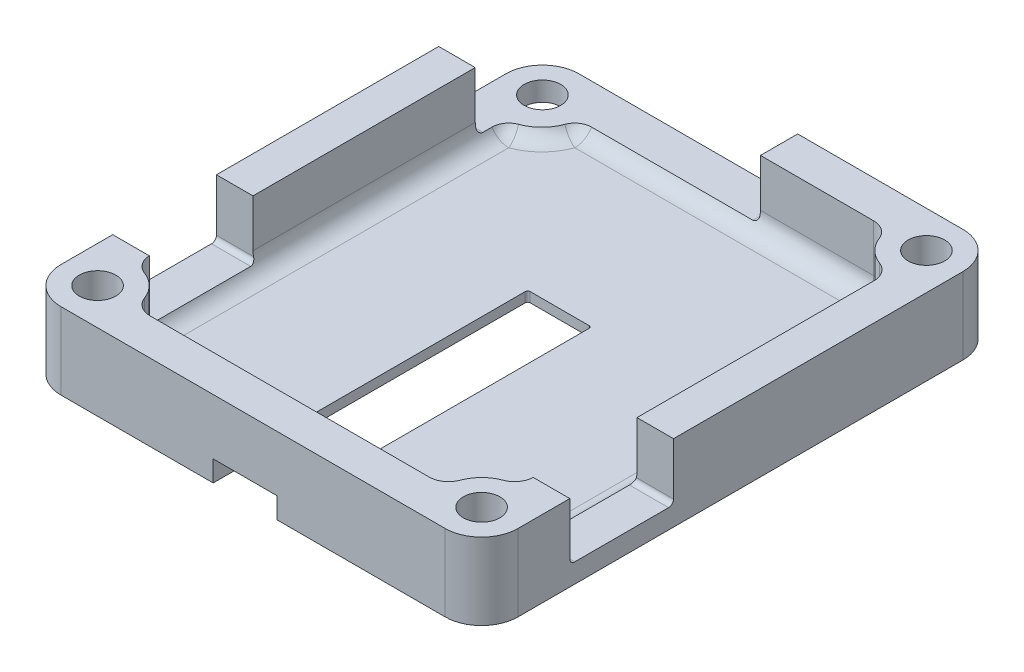
from build123d import *

# Parameters (mm, degrees)
SKETCH1_R               = 2.9972
BOSS_EXTRUDE1_DEPTH     = 12.573
CUT_EXTRUDE3_DEPTH      = 62.511402554
CUT_EXTRUDE3_DEPTH_BACK = 10.9728
FILLET1_R               = 3.175
CUT_EXTRUDE1_DEPTH      = 3.429
CUT_EXTRUDE1_DEPTH_BACK = 62.511402554
SKETCH6_W               = 75.0062
SKETCH6_H               = 17.018
SKETCH6_W_2             = 41.8846
CUT_EXTRUDE4_DEPTH      = 9.398
FILLET2_R               = 0.8128


with BuildPart() as part:
    # Sketch1 → Boss-Extrude1 (new body)
    with BuildSketch(Plane(origin=(0, 0, 0), x_dir=(1, 0, 0), z_dir=(0, 1, 0))):
        with BuildLine():
            Line((-29.1688495, -45.1454495), (33.8485505, -45.1454495))
            ThreePointArc((33.8485505, -45.1454495), (38.087231389, -43.389730389), (39.8429505, -39.1510495))
            Line((39.8429505, -39.1510495), (39.8429505, 33.8485505))
            ThreePointArc((39.8429505, 33.8485505), (38.087231389, 38.087231389), (33.8485505, 39.8429505))
            Line((33.8485505, 39.8429505), (-29.1688495, 39.8429505))
            ThreePointArc((-29.1688495, 39.8429505), (-33.407530389, 38.087231389), (-35.1632495, 33.8485505))
            Line((-35.1632495, 33.8485505), (-35.1632495, -39.1510495))
            ThreePointArc((-35.1632495, -39.1510495), (-33.407530389, -43.389730389), (-29.1688495, -45.1454495))
        make_face()
        with Locations(Location((-29.1688495, 33.8485505, 0), (0, 0, 270))):
            Circle(SKETCH1_R, mode=Mode.SUBTRACT)
        with Locations(Location((33.8485505, 33.8485505, 0), (0, 0, 270))):
            Circle(SKETCH1_R, mode=Mode.SUBTRACT)
        with Locations(Location((33.8485505, -39.1510495, 0), (0, 0, 270))):
            Circle(SKETCH1_R, mode=Mode.SUBTRACT)
        with Locations(Location((-29.1688495, -39.1510495, 0), (0, 0, 270))):
            Circle(SKETCH1_R, mode=Mode.SUBTRACT)
    extrude(amount=BOSS_EXTRUDE1_DEPTH)

    # Sketch5 → Cut-Extrude3 (cut, two sides: drawn at the far end of the back side and taken through both)
    with BuildSketch(Plane(origin=(0, 12.573, 0), x_dir=(1, 0, 0), z_dir=(0, 1, 0)).offset(-CUT_EXTRUDE3_DEPTH_BACK)):
        with BuildLine():
            Line((-20.566682833, -39.1510495), (25.246383833, -39.1510495))
            ThreePointArc((25.246383833, -39.1510495), (27.061611626, -38.580962754), (28.224973399, -37.075426231))
            ThreePointArc((28.224973399, -37.075426231), (29.609869611, -34.912368611), (31.772927231, -33.527472399))
            ThreePointArc((31.772927231, -33.527472399), (33.278463754, -32.364110626), (33.8485505, -30.548882833))
            Line((33.8485505, -30.548882833), (33.8485505, 25.246383833))
            ThreePointArc((33.8485505, 25.246383833), (33.278463754, 27.061611626), (31.772927231, 28.224973399))
            ThreePointArc((31.772927231, 28.224973399), (29.637195811, 29.582718454), (28.25211412, 31.700823514))
            ThreePointArc((28.25211412, 31.700823514), (27.086350512, 33.179780767), (25.287899936, 33.738256255))
            Line((25.287899936, 33.738256255), (-20.566682833, 33.738256255))
            ThreePointArc((-20.566682833, 33.738256255), (-22.381910626, 33.168169509), (-23.545272399, 31.662632986))
            ThreePointArc((-23.545272399, 31.662632986), (-24.930168611, 29.499575366), (-27.093226231, 28.114679154))
            ThreePointArc((-27.093226231, 28.114679154), (-28.598762754, 26.951317381), (-29.1688495, 25.136089588))
            Line((-29.1688495, 25.136089588), (-29.1688495, -30.548882833))
            ThreePointArc((-29.1688495, -30.548882833), (-28.598762754, -32.364110626), (-27.093226231, -33.527472399))
            ThreePointArc((-27.093226231, -33.527472399), (-24.930168611, -34.912368611), (-23.545272399, -37.075426231))
            ThreePointArc((-23.545272399, -37.075426231), (-22.381910626, -38.580962754), (-20.566682833, -39.1510495))
        make_face()
    extrude(amount=CUT_EXTRUDE3_DEPTH + CUT_EXTRUDE3_DEPTH_BACK, mode=Mode.SUBTRACT)

    # Fillet1
    fillet1_edges = [part.edges().sort_by_distance(p)[0] for p in [
        (-22.381910626, 1.6002, -33.168169509),
        (-24.930168611, 1.6002, -29.499575366),
        (-28.598762754, 1.6002, -26.951317381),
        (-29.1688495, 1.6002, 2.706396623),
        (2.3398505, 1.6002, 39.1510495),
        (27.061611626, 1.6002, 38.580962754),
        (29.609869611, 1.6002, 34.912368611),
        (33.278463754, 1.6002, 32.364110626),
        (33.8485505, 1.6002, 2.6512495),
        (33.278463754, 1.6002, -27.061611626),
        (29.637195811, 1.6002, -29.582718454),
        (27.086350512, 1.6002, -33.179780767),
        (2.360608551, 1.6002, -33.738256255),
        (-28.598762754, 1.6002, 32.364110626),
        (-24.930168611, 1.6002, 34.912368611),
        (-22.381910626, 1.6002, 38.580962754),
    ]]
    fillet(fillet1_edges, radius=FILLET1_R)

    # Sketch2 → Cut-Extrude1 (cut, two sides: drawn at the far end of the back side and taken through both)
    with BuildSketch(Plane(origin=(0, 0, 0), x_dir=(1, 0, 0), z_dir=(0, 1, 0)).offset(-CUT_EXTRUDE1_DEPTH_BACK)):
        with BuildLine():
            Line((-4.2006495, -45.1454495), (6.2641505, -45.1454495))
            Line((6.2641505, -45.1454495), (6.2641505, 6.0609505))
            ThreePointArc((6.2641505, 6.0609505), (6.145118696, 6.348318696), (5.8577505, 6.4673505))
            Line((5.8577505, 6.4673505), (-3.7942495, 6.4673505))
            ThreePointArc((-3.7942495, 6.4673505), (-4.081617696, 6.348318696), (-4.2006495, 6.0609505))
            Line((-4.2006495, 6.0609505), (-4.2006495, -45.1454495))
        make_face()
    extrude(amount=CUT_EXTRUDE1_DEPTH + CUT_EXTRUDE1_DEPTH_BACK, mode=Mode.SUBTRACT)

    # Sketch6 → Cut-Extrude4 (cut)
    with BuildSketch(Plane(origin=(0, 12.573, 0), x_dir=(1, 0, 0), z_dir=(0, 1, 0))):
        with Locations((2.3398505, -22.1584495)):
            Rectangle(SKETCH6_W, SKETCH6_H)
        with Locations((-14.2209495, 31.3339505)):
            Rectangle(SKETCH6_W_2, SKETCH6_H)
    extrude(amount=-CUT_EXTRUDE4_DEPTH, mode=Mode.SUBTRACT)

    # Fillet2
    fillet2_edges = [part.edges().sort_by_distance(p)[0] for p in [
        (36.629380049, 3.175, 13.6494495),
        (36.628097837, 3.175, 30.6674495),
        (-31.948396837, 3.175, 30.6674495),
        (-31.949679049, 3.175, 13.6494495),
        (-31.949679049, 3.175, -22.8249505),
        (6.7213505, 3.175, -36.574232926),
    ]]
    fillet(fillet2_edges, radius=FILLET2_R)


solid = part.part
